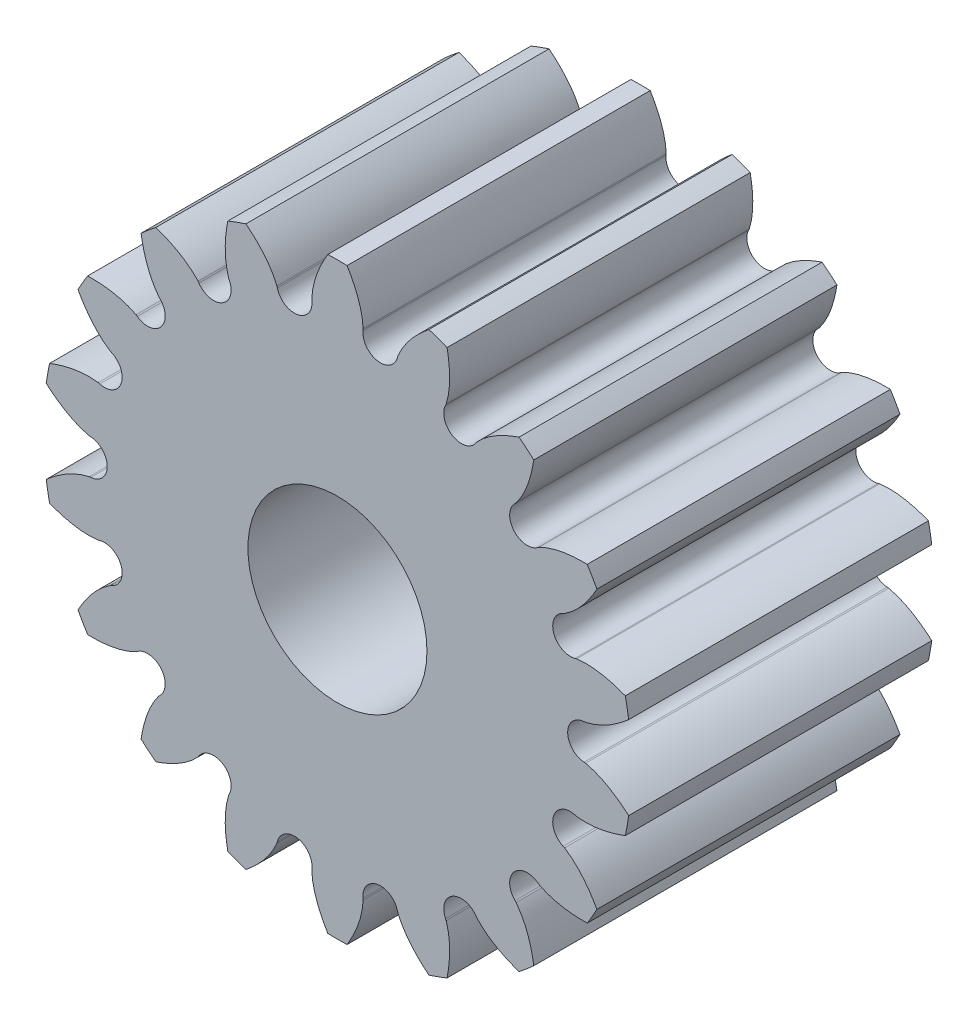
from build123d import *

# Parameters (mm, degrees)
SKETCH3_R                      = 2.286
SKETCH3_R_2                    = 0.889
BASE_DEPTH                     = 3.0099
HALF_TOOTH_DEPTH               = 3.0099
PATTERN_OF_TOOTH_COUNT         = 18
PATTERN_OF_TOOTH_COPY_1_DEPTH  = 3.0099
PATTERN_OF_TOOTH_COPY_2_DEPTH  = 3.0099
PATTERN_OF_TOOTH_COPY_3_DEPTH  = 3.0099
PATTERN_OF_TOOTH_COPY_4_DEPTH  = 3.0099
PATTERN_OF_TOOTH_COPY_5_DEPTH  = 3.0099
PATTERN_OF_TOOTH_COPY_6_DEPTH  = 3.0099
PATTERN_OF_TOOTH_COPY_7_DEPTH  = 3.0099
PATTERN_OF_TOOTH_COPY_8_DEPTH  = 3.0099
PATTERN_OF_TOOTH_COPY_9_DEPTH  = 3.0099
PATTERN_OF_TOOTH_COPY_10_DEPTH = 3.0099
PATTERN_OF_TOOTH_COPY_11_DEPTH = 3.0099
PATTERN_OF_TOOTH_COPY_12_DEPTH = 3.0099
PATTERN_OF_TOOTH_COPY_13_DEPTH = 3.0099
PATTERN_OF_TOOTH_COPY_14_DEPTH = 3.0099
PATTERN_OF_TOOTH_COPY_15_DEPTH = 3.0099
PATTERN_OF_TOOTH_COPY_16_DEPTH = 3.0099
PATTERN_OF_TOOTH_COPY_17_DEPTH = 3.0099


with BuildPart() as part:
    # Sketch3 → Base (new body)
    with BuildSketch(Plane.XY):
        Circle(SKETCH3_R)
        Circle(SKETCH3_R_2, mode=Mode.SUBTRACT)
    extrude(amount=BASE_DEPTH)

    # Sketch2 → Half tooth (add)
    with BuildSketch(Plane.XY):
        with BuildLine():
            Line((0, 2.921), (0, 2.286))
            ThreePointArc((0, 2.286), (0.199238028, 2.27730108), (0.396959734, 2.251270523))
            ThreePointArc((0.396959734, 2.251270523), (0.28773176, 2.318156306), (0.253382626, 2.441544292))
            Line((0.253382626, 2.441544292), (0.255003353, 2.457161288))
            add(Edge.make_bspline(
                [(0.255003353, 2.457161288), (0.25245669, 2.511970923), (0.22493294, 2.674677864), (0.152013752, 2.825486334), (0.095650308, 2.91943351)],
                knots=[0, 0, 0, 0, 0.332628043, 1, 1, 1, 1], degree=3))
            ThreePointArc((0.095650308, 2.91943351), (0.047831567, 2.920608351), (0, 2.921))
        make_face()
    half_tooth = extrude(amount=HALF_TOOTH_DEPTH)

    # Mirror of half tooth: Half tooth across plane
    add(half_tooth.mirror(Plane.ZY))

    # Pattern of tooth: Half tooth ×18 about axis
    pattern_of_tooth_axis = Axis((0, 0, 0), (0, 0, -1))
    for i in range(1, PATTERN_OF_TOOTH_COUNT):
        add(half_tooth.rotate(pattern_of_tooth_axis, i * 360 / PATTERN_OF_TOOTH_COUNT))

    # Pattern of tooth copy 1 sketch → Pattern of tooth copy 1 (add)
    with BuildSketch(Plane(origin=(0, 0, 0), x_dir=(-0.9396926207859084, 0.3420201433256687, 0), z_dir=(0, 0, 1))):
        with BuildLine():
            Line((0, -2.921), (0, -2.286))
            ThreePointArc((0, -2.286), (0.199238028, -2.27730108), (0.396959734, -2.251270523))
            ThreePointArc((0.396959734, -2.251270523), (0.28773176, -2.318156306), (0.253382626, -2.441544292))
            Line((0.253382626, -2.441544292), (0.255003353, -2.457161288))
            add(Edge.make_bspline(
                [(0.255003353, -2.457161288), (0.25245669, -2.511970923), (0.22493294, -2.674677864), (0.152013752, -2.825486334), (0.095650308, -2.91943351)],
                knots=[0, 0, 0, 0, 0.332628043, 1, 1, 1, 1], degree=3))
            ThreePointArc((0.095650308, -2.91943351), (0.047831567, -2.920608351), (0, -2.921))
        make_face()
    extrude(amount=PATTERN_OF_TOOTH_COPY_1_DEPTH)

    # Pattern of tooth copy 2 sketch → Pattern of tooth copy 2 (add)
    with BuildSketch(Plane(origin=(0, 0, 0), x_dir=(-0.766044443118978, 0.6427876096865393, 0), z_dir=(0, 0, 1))):
        with BuildLine():
            Line((0, -2.921), (0, -2.286))
            ThreePointArc((0, -2.286), (0.199238028, -2.27730108), (0.396959734, -2.251270523))
            ThreePointArc((0.396959734, -2.251270523), (0.28773176, -2.318156306), (0.253382626, -2.441544292))
            Line((0.253382626, -2.441544292), (0.255003353, -2.457161288))
            add(Edge.make_bspline(
                [(0.255003353, -2.457161288), (0.25245669, -2.511970923), (0.22493294, -2.674677864), (0.152013752, -2.825486334), (0.095650308, -2.91943351)],
                knots=[0, 0, 0, 0, 0.332628043, 1, 1, 1, 1], degree=3))
            ThreePointArc((0.095650308, -2.91943351), (0.047831567, -2.920608351), (0, -2.921))
        make_face()
    extrude(amount=PATTERN_OF_TOOTH_COPY_2_DEPTH)

    # Pattern of tooth copy 3 sketch → Pattern of tooth copy 3 (add)
    with BuildSketch(Plane(origin=(0, 0, 0), x_dir=(-0.5000000000000001, 0.8660254037844386, 0), z_dir=(0, 0, 1))):
        with BuildLine():
            Line((0, -2.921), (0, -2.286))
            ThreePointArc((0, -2.286), (0.199238028, -2.27730108), (0.396959734, -2.251270523))
            ThreePointArc((0.396959734, -2.251270523), (0.28773176, -2.318156306), (0.253382626, -2.441544292))
            Line((0.253382626, -2.441544292), (0.255003353, -2.457161288))
            add(Edge.make_bspline(
                [(0.255003353, -2.457161288), (0.25245669, -2.511970923), (0.22493294, -2.674677864), (0.152013752, -2.825486334), (0.095650308, -2.91943351)],
                knots=[0, 0, 0, 0, 0.332628043, 1, 1, 1, 1], degree=3))
            ThreePointArc((0.095650308, -2.91943351), (0.047831567, -2.920608351), (0, -2.921))
        make_face()
    extrude(amount=PATTERN_OF_TOOTH_COPY_3_DEPTH)

    # Pattern of tooth copy 4 sketch → Pattern of tooth copy 4 (add)
    with BuildSketch(Plane(origin=(0, 0, 0), x_dir=(-0.17364817766693041, 0.984807753012208, 0), z_dir=(0, 0, 1))):
        with BuildLine():
            Line((0, -2.921), (0, -2.286))
            ThreePointArc((0, -2.286), (0.199238028, -2.27730108), (0.396959734, -2.251270523))
            ThreePointArc((0.396959734, -2.251270523), (0.28773176, -2.318156306), (0.253382626, -2.441544292))
            Line((0.253382626, -2.441544292), (0.255003353, -2.457161288))
            add(Edge.make_bspline(
                [(0.255003353, -2.457161288), (0.25245669, -2.511970923), (0.22493294, -2.674677864), (0.152013752, -2.825486334), (0.095650308, -2.91943351)],
                knots=[0, 0, 0, 0, 0.332628043, 1, 1, 1, 1], degree=3))
            ThreePointArc((0.095650308, -2.91943351), (0.047831567, -2.920608351), (0, -2.921))
        make_face()
    extrude(amount=PATTERN_OF_TOOTH_COPY_4_DEPTH)

    # Pattern of tooth copy 5 sketch → Pattern of tooth copy 5 (add)
    with BuildSketch(Plane(origin=(0, 0, 0), x_dir=(0.1736481776669303, 0.984807753012208, 0), z_dir=(0, 0, 1))):
        with BuildLine():
            Line((0, -2.921), (0, -2.286))
            ThreePointArc((0, -2.286), (0.199238028, -2.27730108), (0.396959734, -2.251270523))
            ThreePointArc((0.396959734, -2.251270523), (0.28773176, -2.318156306), (0.253382626, -2.441544292))
            Line((0.253382626, -2.441544292), (0.255003353, -2.457161288))
            add(Edge.make_bspline(
                [(0.255003353, -2.457161288), (0.25245669, -2.511970923), (0.22493294, -2.674677864), (0.152013752, -2.825486334), (0.095650308, -2.91943351)],
                knots=[0, 0, 0, 0, 0.332628043, 1, 1, 1, 1], degree=3))
            ThreePointArc((0.095650308, -2.91943351), (0.047831567, -2.920608351), (0, -2.921))
        make_face()
    extrude(amount=PATTERN_OF_TOOTH_COPY_5_DEPTH)

    # Pattern of tooth copy 6 sketch → Pattern of tooth copy 6 (add)
    with BuildSketch(Plane(origin=(0, 0, 0), x_dir=(0.4999999999999998, 0.8660254037844387, 0), z_dir=(0, 0, 1))):
        with BuildLine():
            Line((0, -2.921), (0, -2.286))
            ThreePointArc((0, -2.286), (0.199238028, -2.27730108), (0.396959734, -2.251270523))
            ThreePointArc((0.396959734, -2.251270523), (0.28773176, -2.318156306), (0.253382626, -2.441544292))
            Line((0.253382626, -2.441544292), (0.255003353, -2.457161288))
            add(Edge.make_bspline(
                [(0.255003353, -2.457161288), (0.25245669, -2.511970923), (0.22493294, -2.674677864), (0.152013752, -2.825486334), (0.095650308, -2.91943351)],
                knots=[0, 0, 0, 0, 0.332628043, 1, 1, 1, 1], degree=3))
            ThreePointArc((0.095650308, -2.91943351), (0.047831567, -2.920608351), (0, -2.921))
        make_face()
    extrude(amount=PATTERN_OF_TOOTH_COPY_6_DEPTH)

    # Pattern of tooth copy 7 sketch → Pattern of tooth copy 7 (add)
    with BuildSketch(Plane(origin=(0, 0, 0), x_dir=(0.7660444431189779, 0.6427876096865395, 0), z_dir=(0, 0, 1))):
        with BuildLine():
            Line((0, -2.921), (0, -2.286))
            ThreePointArc((0, -2.286), (0.199238028, -2.27730108), (0.396959734, -2.251270523))
            ThreePointArc((0.396959734, -2.251270523), (0.28773176, -2.318156306), (0.253382626, -2.441544292))
            Line((0.253382626, -2.441544292), (0.255003353, -2.457161288))
            add(Edge.make_bspline(
                [(0.255003353, -2.457161288), (0.25245669, -2.511970923), (0.22493294, -2.674677864), (0.152013752, -2.825486334), (0.095650308, -2.91943351)],
                knots=[0, 0, 0, 0, 0.332628043, 1, 1, 1, 1], degree=3))
            ThreePointArc((0.095650308, -2.91943351), (0.047831567, -2.920608351), (0, -2.921))
        make_face()
    extrude(amount=PATTERN_OF_TOOTH_COPY_7_DEPTH)

    # Pattern of tooth copy 8 sketch → Pattern of tooth copy 8 (add)
    with BuildSketch(Plane(origin=(0, 0, 0), x_dir=(0.9396926207859083, 0.3420201433256689, 0), z_dir=(0, 0, 1))):
        with BuildLine():
            Line((0, -2.921), (0, -2.286))
            ThreePointArc((0, -2.286), (0.199238028, -2.27730108), (0.396959734, -2.251270523))
            ThreePointArc((0.396959734, -2.251270523), (0.28773176, -2.318156306), (0.253382626, -2.441544292))
            Line((0.253382626, -2.441544292), (0.255003353, -2.457161288))
            add(Edge.make_bspline(
                [(0.255003353, -2.457161288), (0.25245669, -2.511970923), (0.22493294, -2.674677864), (0.152013752, -2.825486334), (0.095650308, -2.91943351)],
                knots=[0, 0, 0, 0, 0.332628043, 1, 1, 1, 1], degree=3))
            ThreePointArc((0.095650308, -2.91943351), (0.047831567, -2.920608351), (0, -2.921))
        make_face()
    extrude(amount=PATTERN_OF_TOOTH_COPY_8_DEPTH)

    # Pattern of tooth copy 9 sketch → Pattern of tooth copy 9 (add)
    with BuildSketch(Plane.XY):
        with BuildLine():
            Line((0, -2.921), (0, -2.286))
            ThreePointArc((0, -2.286), (0.199238028, -2.27730108), (0.396959734, -2.251270523))
            ThreePointArc((0.396959734, -2.251270523), (0.28773176, -2.318156306), (0.253382626, -2.441544292))
            Line((0.253382626, -2.441544292), (0.255003353, -2.457161288))
            add(Edge.make_bspline(
                [(0.255003353, -2.457161288), (0.25245669, -2.511970923), (0.22493294, -2.674677864), (0.152013752, -2.825486334), (0.095650308, -2.91943351)],
                knots=[0, 0, 0, 0, 0.332628043, 1, 1, 1, 1], degree=3))
            ThreePointArc((0.095650308, -2.91943351), (0.047831567, -2.920608351), (0, -2.921))
        make_face()
    extrude(amount=PATTERN_OF_TOOTH_COPY_9_DEPTH)

    # Pattern of tooth copy 10 sketch → Pattern of tooth copy 10 (add)
    with BuildSketch(Plane(origin=(0, 0, 0), x_dir=(0.9396926207859084, -0.34202014332566866, 0), z_dir=(0, 0, 1))):
        with BuildLine():
            Line((0, -2.921), (0, -2.286))
            ThreePointArc((0, -2.286), (0.199238028, -2.27730108), (0.396959734, -2.251270523))
            ThreePointArc((0.396959734, -2.251270523), (0.28773176, -2.318156306), (0.253382626, -2.441544292))
            Line((0.253382626, -2.441544292), (0.255003353, -2.457161288))
            add(Edge.make_bspline(
                [(0.255003353, -2.457161288), (0.25245669, -2.511970923), (0.22493294, -2.674677864), (0.152013752, -2.825486334), (0.095650308, -2.91943351)],
                knots=[0, 0, 0, 0, 0.332628043, 1, 1, 1, 1], degree=3))
            ThreePointArc((0.095650308, -2.91943351), (0.047831567, -2.920608351), (0, -2.921))
        make_face()
    extrude(amount=PATTERN_OF_TOOTH_COPY_10_DEPTH)

    # Pattern of tooth copy 11 sketch → Pattern of tooth copy 11 (add)
    with BuildSketch(Plane(origin=(0, 0, 0), x_dir=(0.766044443118978, -0.6427876096865393, 0), z_dir=(0, 0, 1))):
        with BuildLine():
            Line((0, -2.921), (0, -2.286))
            ThreePointArc((0, -2.286), (0.199238028, -2.27730108), (0.396959734, -2.251270523))
            ThreePointArc((0.396959734, -2.251270523), (0.28773176, -2.318156306), (0.253382626, -2.441544292))
            Line((0.253382626, -2.441544292), (0.255003353, -2.457161288))
            add(Edge.make_bspline(
                [(0.255003353, -2.457161288), (0.25245669, -2.511970923), (0.22493294, -2.674677864), (0.152013752, -2.825486334), (0.095650308, -2.91943351)],
                knots=[0, 0, 0, 0, 0.332628043, 1, 1, 1, 1], degree=3))
            ThreePointArc((0.095650308, -2.91943351), (0.047831567, -2.920608351), (0, -2.921))
        make_face()
    extrude(amount=PATTERN_OF_TOOTH_COPY_11_DEPTH)

    # Pattern of tooth copy 12 sketch → Pattern of tooth copy 12 (add)
    with BuildSketch(Plane(origin=(0, 0, 0), x_dir=(0.5000000000000004, -0.8660254037844384, 0), z_dir=(0, 0, 1))):
        with BuildLine():
            Line((0, -2.921), (0, -2.286))
            ThreePointArc((0, -2.286), (0.199238028, -2.27730108), (0.396959734, -2.251270523))
            ThreePointArc((0.396959734, -2.251270523), (0.28773176, -2.318156306), (0.253382626, -2.441544292))
            Line((0.253382626, -2.441544292), (0.255003353, -2.457161288))
            add(Edge.make_bspline(
                [(0.255003353, -2.457161288), (0.25245669, -2.511970923), (0.22493294, -2.674677864), (0.152013752, -2.825486334), (0.095650308, -2.91943351)],
                knots=[0, 0, 0, 0, 0.332628043, 1, 1, 1, 1], degree=3))
            ThreePointArc((0.095650308, -2.91943351), (0.047831567, -2.920608351), (0, -2.921))
        make_face()
    extrude(amount=PATTERN_OF_TOOTH_COPY_12_DEPTH)

    # Pattern of tooth copy 13 sketch → Pattern of tooth copy 13 (add)
    with BuildSketch(Plane(origin=(0, 0, 0), x_dir=(0.17364817766693033, -0.984807753012208, 0), z_dir=(0, 0, 1))):
        with BuildLine():
            Line((0, -2.921), (0, -2.286))
            ThreePointArc((0, -2.286), (0.199238028, -2.27730108), (0.396959734, -2.251270523))
            ThreePointArc((0.396959734, -2.251270523), (0.28773176, -2.318156306), (0.253382626, -2.441544292))
            Line((0.253382626, -2.441544292), (0.255003353, -2.457161288))
            add(Edge.make_bspline(
                [(0.255003353, -2.457161288), (0.25245669, -2.511970923), (0.22493294, -2.674677864), (0.152013752, -2.825486334), (0.095650308, -2.91943351)],
                knots=[0, 0, 0, 0, 0.332628043, 1, 1, 1, 1], degree=3))
            ThreePointArc((0.095650308, -2.91943351), (0.047831567, -2.920608351), (0, -2.921))
        make_face()
    extrude(amount=PATTERN_OF_TOOTH_COPY_13_DEPTH)

    # Pattern of tooth copy 14 sketch → Pattern of tooth copy 14 (add)
    with BuildSketch(Plane(origin=(0, 0, 0), x_dir=(-0.17364817766692997, -0.9848077530122081, 0), z_dir=(0, 0, 1))):
        with BuildLine():
            Line((0, -2.921), (0, -2.286))
            ThreePointArc((0, -2.286), (0.199238028, -2.27730108), (0.396959734, -2.251270523))
            ThreePointArc((0.396959734, -2.251270523), (0.28773176, -2.318156306), (0.253382626, -2.441544292))
            Line((0.253382626, -2.441544292), (0.255003353, -2.457161288))
            add(Edge.make_bspline(
                [(0.255003353, -2.457161288), (0.25245669, -2.511970923), (0.22493294, -2.674677864), (0.152013752, -2.825486334), (0.095650308, -2.91943351)],
                knots=[0, 0, 0, 0, 0.332628043, 1, 1, 1, 1], degree=3))
            ThreePointArc((0.095650308, -2.91943351), (0.047831567, -2.920608351), (0, -2.921))
        make_face()
    extrude(amount=PATTERN_OF_TOOTH_COPY_14_DEPTH)

    # Pattern of tooth copy 15 sketch → Pattern of tooth copy 15 (add)
    with BuildSketch(Plane(origin=(0, 0, 0), x_dir=(-0.5000000000000001, -0.8660254037844386, 0), z_dir=(0, 0, 1))):
        with BuildLine():
            Line((0, -2.921), (0, -2.286))
            ThreePointArc((0, -2.286), (0.199238028, -2.27730108), (0.396959734, -2.251270523))
            ThreePointArc((0.396959734, -2.251270523), (0.28773176, -2.318156306), (0.253382626, -2.441544292))
            Line((0.253382626, -2.441544292), (0.255003353, -2.457161288))
            add(Edge.make_bspline(
                [(0.255003353, -2.457161288), (0.25245669, -2.511970923), (0.22493294, -2.674677864), (0.152013752, -2.825486334), (0.095650308, -2.91943351)],
                knots=[0, 0, 0, 0, 0.332628043, 1, 1, 1, 1], degree=3))
            ThreePointArc((0.095650308, -2.91943351), (0.047831567, -2.920608351), (0, -2.921))
        make_face()
    extrude(amount=PATTERN_OF_TOOTH_COPY_15_DEPTH)

    # Pattern of tooth copy 16 sketch → Pattern of tooth copy 16 (add)
    with BuildSketch(Plane(origin=(0, 0, 0), x_dir=(-0.7660444431189778, -0.6427876096865396, 0), z_dir=(0, 0, 1))):
        with BuildLine():
            Line((0, -2.921), (0, -2.286))
            ThreePointArc((0, -2.286), (0.199238028, -2.27730108), (0.396959734, -2.251270523))
            ThreePointArc((0.396959734, -2.251270523), (0.28773176, -2.318156306), (0.253382626, -2.441544292))
            Line((0.253382626, -2.441544292), (0.255003353, -2.457161288))
            add(Edge.make_bspline(
                [(0.255003353, -2.457161288), (0.25245669, -2.511970923), (0.22493294, -2.674677864), (0.152013752, -2.825486334), (0.095650308, -2.91943351)],
                knots=[0, 0, 0, 0, 0.332628043, 1, 1, 1, 1], degree=3))
            ThreePointArc((0.095650308, -2.91943351), (0.047831567, -2.920608351), (0, -2.921))
        make_face()
    extrude(amount=PATTERN_OF_TOOTH_COPY_16_DEPTH)

    # Pattern of tooth copy 17 sketch → Pattern of tooth copy 17 (add)
    with BuildSketch(Plane(origin=(0, 0, 0), x_dir=(-0.9396926207859084, -0.3420201433256686, 0), z_dir=(0, 0, 1))):
        with BuildLine():
            Line((0, -2.921), (0, -2.286))
            ThreePointArc((0, -2.286), (0.199238028, -2.27730108), (0.396959734, -2.251270523))
            ThreePointArc((0.396959734, -2.251270523), (0.28773176, -2.318156306), (0.253382626, -2.441544292))
            Line((0.253382626, -2.441544292), (0.255003353, -2.457161288))
            add(Edge.make_bspline(
                [(0.255003353, -2.457161288), (0.25245669, -2.511970923), (0.22493294, -2.674677864), (0.152013752, -2.825486334), (0.095650308, -2.91943351)],
                knots=[0, 0, 0, 0, 0.332628043, 1, 1, 1, 1], degree=3))
            ThreePointArc((0.095650308, -2.91943351), (0.047831567, -2.920608351), (0, -2.921))
        make_face()
    extrude(amount=PATTERN_OF_TOOTH_COPY_17_DEPTH)


solid = part.part
